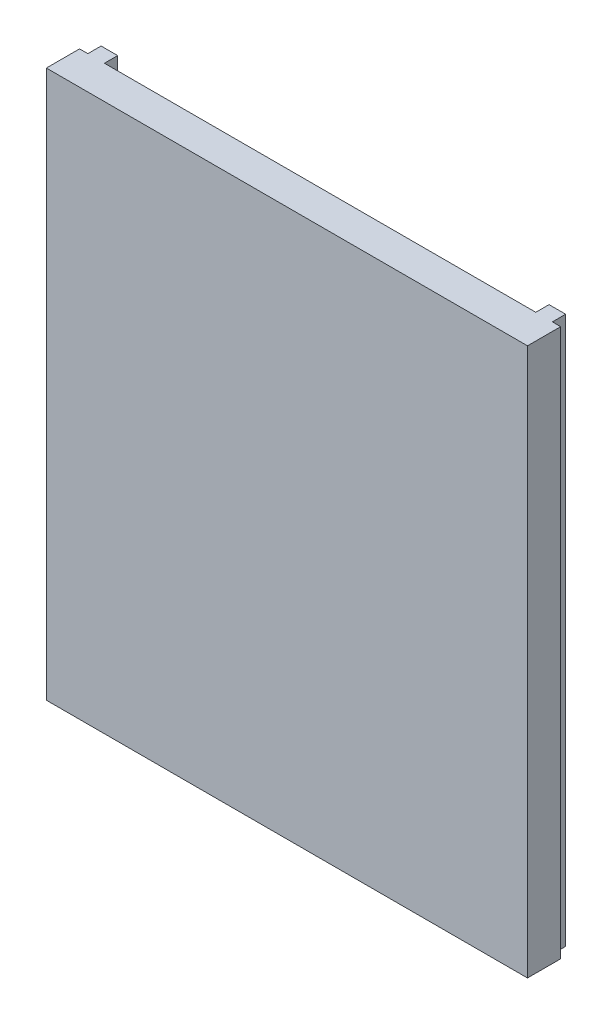
from build123d import *

# Parameters (mm, degrees)
SKETCH3_W           = 29
SKETCH3_H           = 33
BOSS_EXTRUDE1_DEPTH = 2
SKETCH5_W           = 1
SKETCH5_H           = 33
BOSS_EXTRUDE2_DEPTH = 0.8


with BuildPart() as part:
    # Sketch3 → Boss-Extrude1 (new body)
    with BuildSketch(Plane.XY.offset(1)):
        Rectangle(SKETCH3_W, SKETCH3_H)
    extrude(amount=BOSS_EXTRUDE1_DEPTH)

    # Sketch5 → Boss-Extrude2 (add)
    with BuildSketch(Plane(origin=(0, 0, 1), x_dir=(-1, 0, 0), z_dir=(0, 0, -1))):
        with Locations((13.5, 0)):
            Rectangle(SKETCH5_W, SKETCH5_H)
        with Locations((-13.5, 0)):
            Rectangle(SKETCH5_W, SKETCH5_H)
    extrude(amount=BOSS_EXTRUDE2_DEPTH)


solid = part.part
